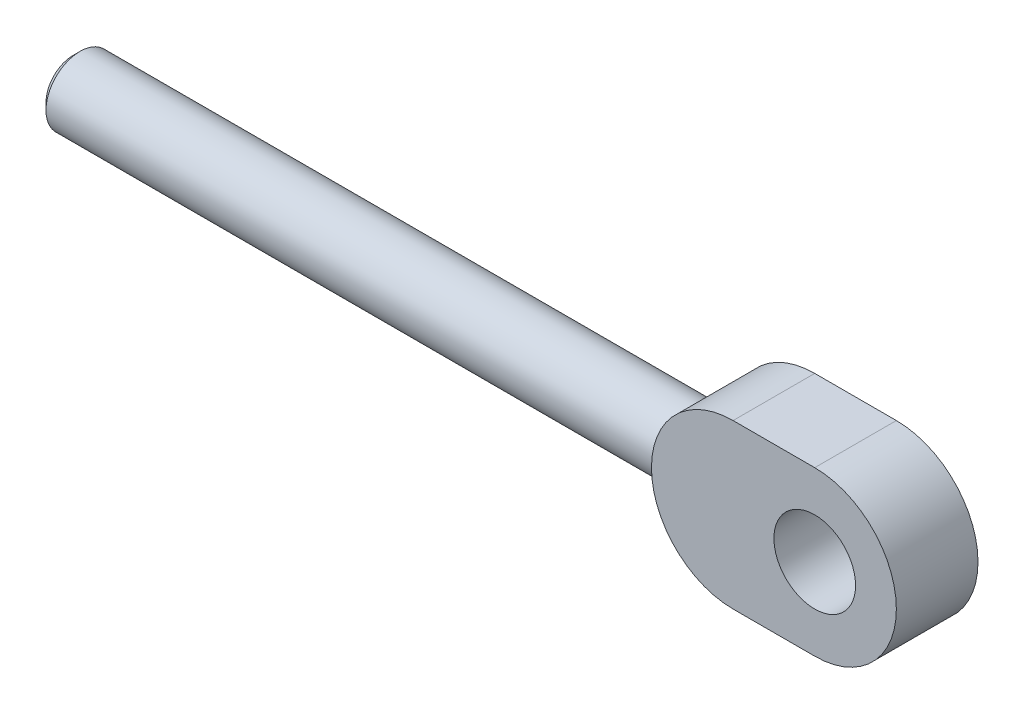
from build123d import *

# Parameters (mm, degrees)
SCHIZZO1_R                        = 6
ESTRUSIONE_ESTRUSIONE1_DEPTH      = 12
ESTRUSIONE_ESTRUSIONE2_REACH      = 130.129
ESTRUSIONE_ESTRUSIONE2_END_RADIUS = 12
SCHIZZO2_R                        = 5
SMUSSO1_SIZE                      = 1


with BuildPart() as part:
    # Schizzo1 → Estrusione-Estrusione1 (new body)
    with BuildSketch(Plane.XY):
        with BuildLine():
            Line((-6, 12), (6, 12))
            ThreePointArc((6, 12), (18, 0), (6, -12))
            Line((6, -12), (-6, -12))
            ThreePointArc((-6, -12), (-18, 0), (-6, 12))
        make_face()
        with Locations((6, 0)):
            Circle(SCHIZZO1_R, mode=Mode.SUBTRACT)
    extrude(amount=ESTRUSIONE_ESTRUSIONE1_DEPTH)

    # Estrusione-Estrusione2: up to this cylinder (the profile starts outside it)
    estrusione_estrusione2_end = Plane(origin=(-6, 0, 6), z_dir=(0, 0, -1)) * Cylinder(ESTRUSIONE_ESTRUSIONE2_END_RADIUS, 285.258, mode=Mode.PRIVATE)
    # Schizzo2 → Estrusione-Estrusione2 (add, up to the surface)
    with BuildSketch(Plane(origin=(-109, 0, 0), x_dir=(0, 0, -1), z_dir=(1, 0, 0)), mode=Mode.PRIVATE) as estrusione_estrusione2_sk1:
        with Locations(Location((-6, 0, 0), (0, 0, 180))):
            Circle(SCHIZZO2_R)
    estrusione_estrusione2_tool1 = extrude(estrusione_estrusione2_sk1.sketch, amount=ESTRUSIONE_ESTRUSIONE2_REACH, mode=Mode.PRIVATE) - estrusione_estrusione2_end
    add(estrusione_estrusione2_tool1.solids().sort_by_distance((-109, 0, 6))[0])

    # Smusso1
    smusso1_edges = [part.edges().sort_by_distance(p)[0] for p in [
        (-109, 0, 1),
    ]]
    chamfer(smusso1_edges, length=SMUSSO1_SIZE)


solid = part.part
